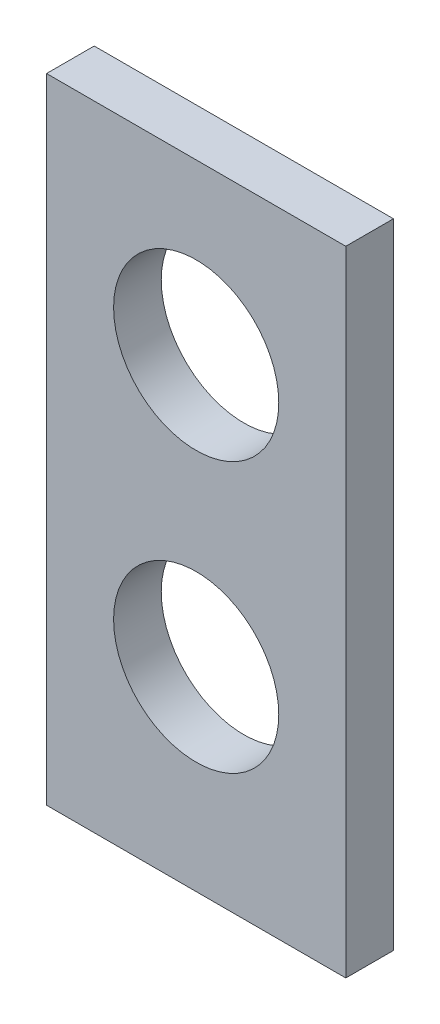
from build123d import *

# Parameters (mm, degrees)
SKETCH1_W           = 94.20384832
SKETCH1_H           = 199.503271976
SKETCH1_R           = 26
BOSS_EXTRUDE1_DEPTH = 15


with BuildPart() as part:
    # Sketch1 → Boss-Extrude1 (new body)
    with BuildSketch(Plane.XY):
        Rectangle(SKETCH1_W, SKETCH1_H)
        with Locations((0, 46.517656328)):
            Circle(SKETCH1_R, mode=Mode.SUBTRACT)
        with Locations((0, -38.482343672)):
            Circle(SKETCH1_R, mode=Mode.SUBTRACT)
    extrude(amount=BOSS_EXTRUDE1_DEPTH)


solid = part.part
